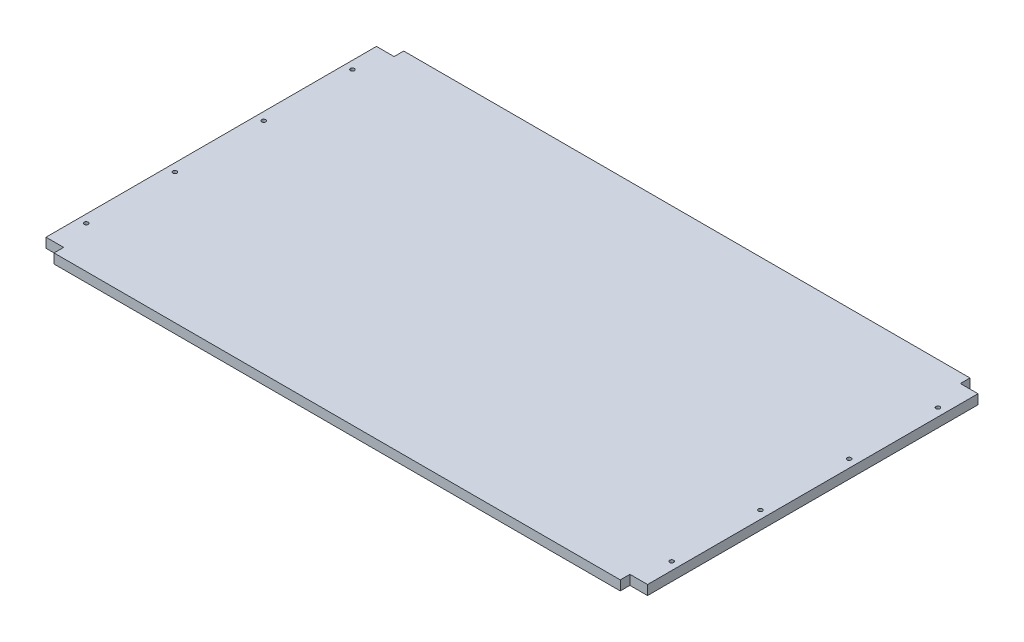
from build123d import *

# Parameters (mm, degrees)
SKETCH1_R           = 2.5
BOSS_EXTRUDE1_DEPTH = 12


with BuildPart() as part:
    # Sketch1 → Boss-Extrude1 (new body)
    with BuildSketch(Plane(origin=(0, 0, 0), x_dir=(1, 0, 0), z_dir=(0, 1, 0))):
        Polygon((0, 0), (0, 12), (-22, 12), (-22, 424), (0, 424), (0, 436), (706, 436), (706, 424), (728, 424), (728, 12), (706, 12), (706, 0), align=None)
        with Locations(Location((-12, 52, 0), (0, 0, 270))):
            Circle(SKETCH1_R, mode=Mode.SUBTRACT)
        with Locations(Location((-12, 162.666666667, 0), (0, 0, 270))):
            Circle(SKETCH1_R, mode=Mode.SUBTRACT)
        with Locations(Location((-12, 273.333333333, 0), (0, 0, 270))):
            Circle(SKETCH1_R, mode=Mode.SUBTRACT)
        with Locations(Location((-12, 384, 0), (0, 0, 270))):
            Circle(SKETCH1_R, mode=Mode.SUBTRACT)
        with Locations(Location((718, 384, 0), (0, 0, 90))):
            Circle(SKETCH1_R, mode=Mode.SUBTRACT)
        with Locations(Location((718, 273.333333333, 0), (0, 0, 90))):
            Circle(SKETCH1_R, mode=Mode.SUBTRACT)
        with Locations(Location((718, 162.666666667, 0), (0, 0, 90))):
            Circle(SKETCH1_R, mode=Mode.SUBTRACT)
        with Locations(Location((718, 52, 0), (0, 0, 90))):
            Circle(SKETCH1_R, mode=Mode.SUBTRACT)
    extrude(amount=BOSS_EXTRUDE1_DEPTH)


solid = part.part
